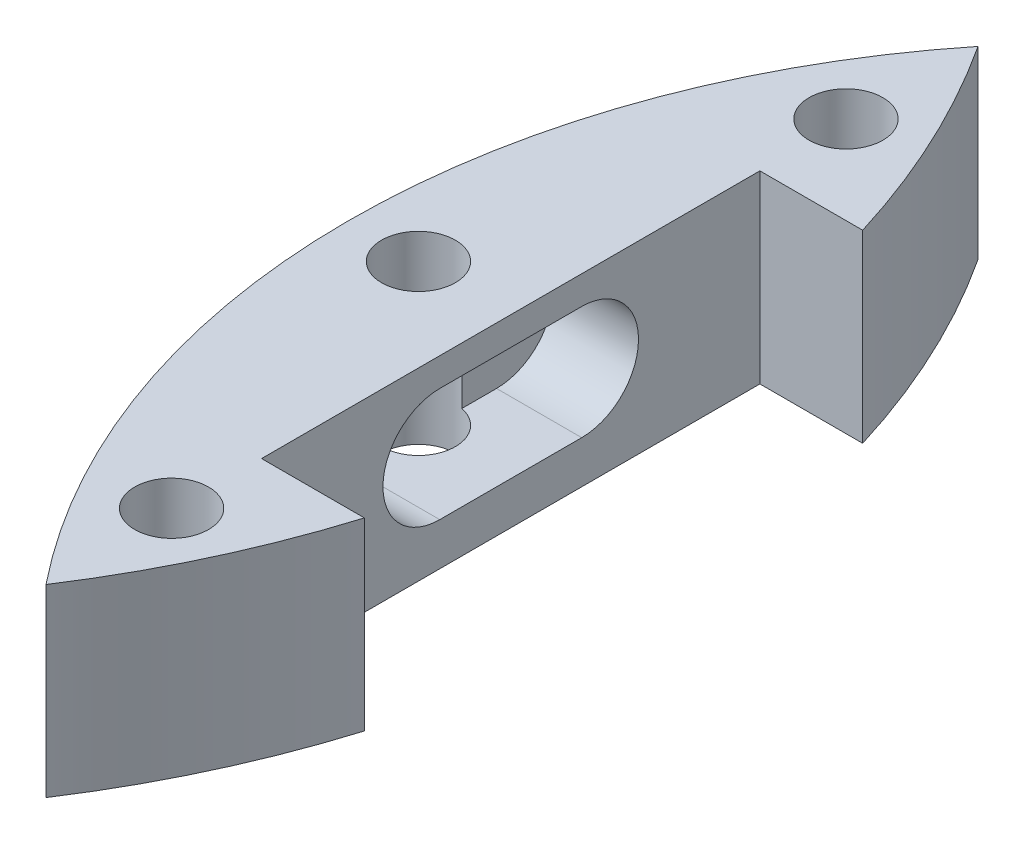
from build123d import *

# Parameters (mm, degrees)
SKETCH_1_R          = 2.6
EXTRUDE_1_DEPTH     = 13
CUT_EXTRUDE_1_DEPTH = 6


with BuildPart() as part:
    # 草图1 → 凸台-拉伸1 (new body)
    with BuildSketch(Plane(origin=(0, 0, 0), x_dir=(1, 0, 0), z_dir=(0, 1, 0))):
        with BuildLine():
            Line((-33.760275315, -17.55), (-41, -17.55))
            Line((-41, -17.55), (-41, 17.55))
            Line((-41, 17.55), (-33.760275315, 17.55))
            ThreePointArc((-33.760275315, 17.55), (-36.796000438, 25.438985546), (-40.910253672, 32.823065739))
            ThreePointArc((-40.910253672, 32.823065739), (-52.45, 0), (-40.910253672, -32.823065739))
            ThreePointArc((-40.910253672, -32.823065739), (-36.796000438, -25.438985546), (-33.760275315, -17.55))
        make_face()
        with Locations(Location((-41.13620668, -23.75, 0), (0, 0, 90))):
            Circle(SKETCH_1_R, mode=Mode.SUBTRACT)
        with Locations(Location((-41.13620668, 23.75, 0), (0, 0, 90))):
            Circle(SKETCH_1_R, mode=Mode.SUBTRACT)
        with Locations(Location((-47.5, 0, 0), (0, 0, 90))):
            Circle(SKETCH_1_R, mode=Mode.SUBTRACT)
    extrude(amount=EXTRUDE_1_DEPTH)

    # 草图3 → 切除-拉伸1 (cut)
    with BuildSketch(Plane(origin=(-41, 0, 0), x_dir=(0, 0, -1), z_dir=(1, 0, 0))):
        with BuildLine():
            Line((-5, 11), (5, 11))
            ThreePointArc((5, 11), (9, 7), (5, 3))
            Line((5, 3), (-5, 3))
            ThreePointArc((-5, 3), (-9, 7), (-5, 11))
        make_face()
    extrude(amount=-CUT_EXTRUDE_1_DEPTH, mode=Mode.SUBTRACT)


solid = part.part
